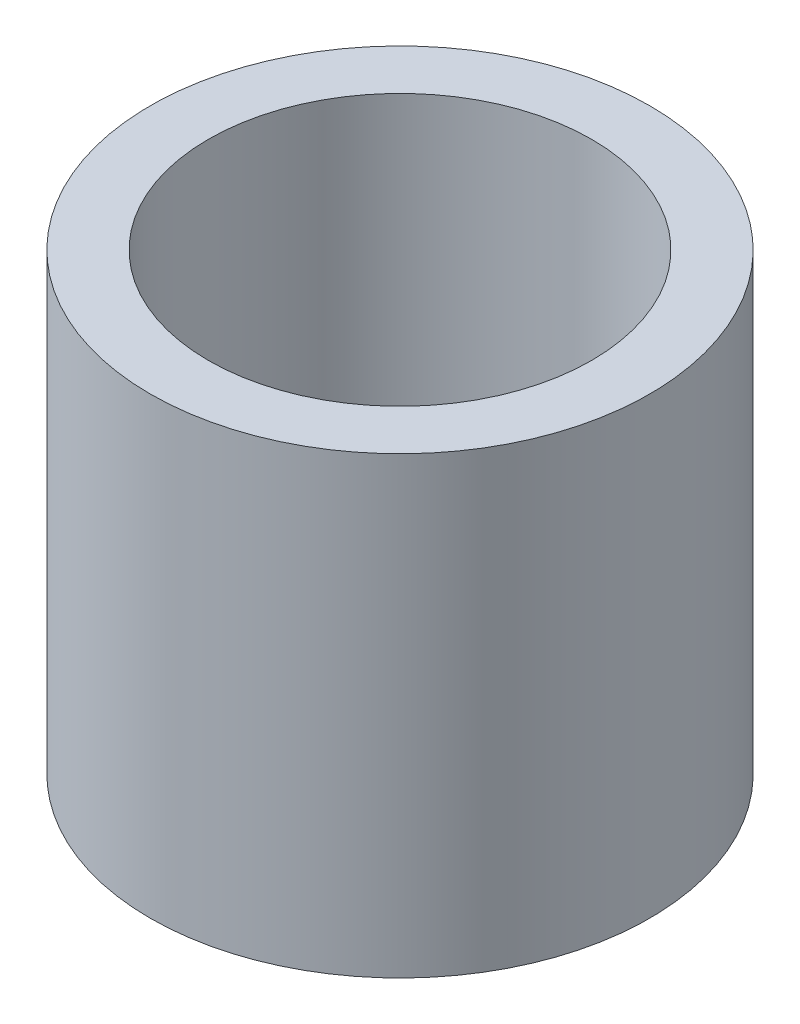
from build123d import *

# Parameters (mm, degrees)
F_6_CLEARANCE_HOLE1_D = 3.7973


with BuildPart() as part:
    # Sketch1 → Revolve1 (revolve)
    with BuildSketch(Plane.XY, mode=Mode.PRIVATE) as revolve1_sk:
        Polygon((13.3985, 31.75), (13.3985, 4.318), (0, 4.318), (0, 0), (17.4625, 0), (17.4625, 31.75), align=None)
    revolve(revolve1_sk.sketch.rotate(Axis((0, 4.318, 0), (0, -1, 0)), 90), axis=Axis((0, 4.318, 0), (0, -1, 0)))

    # #6 Clearance Hole1 (through all)
    with Locations(Plane(origin=(0, 0, 0), x_dir=(-1, 0, 0), z_dir=(0, -1, 0))):
        with Locations((0, 0)):
            Hole(F_6_CLEARANCE_HOLE1_D / 2)


solid = part.part
